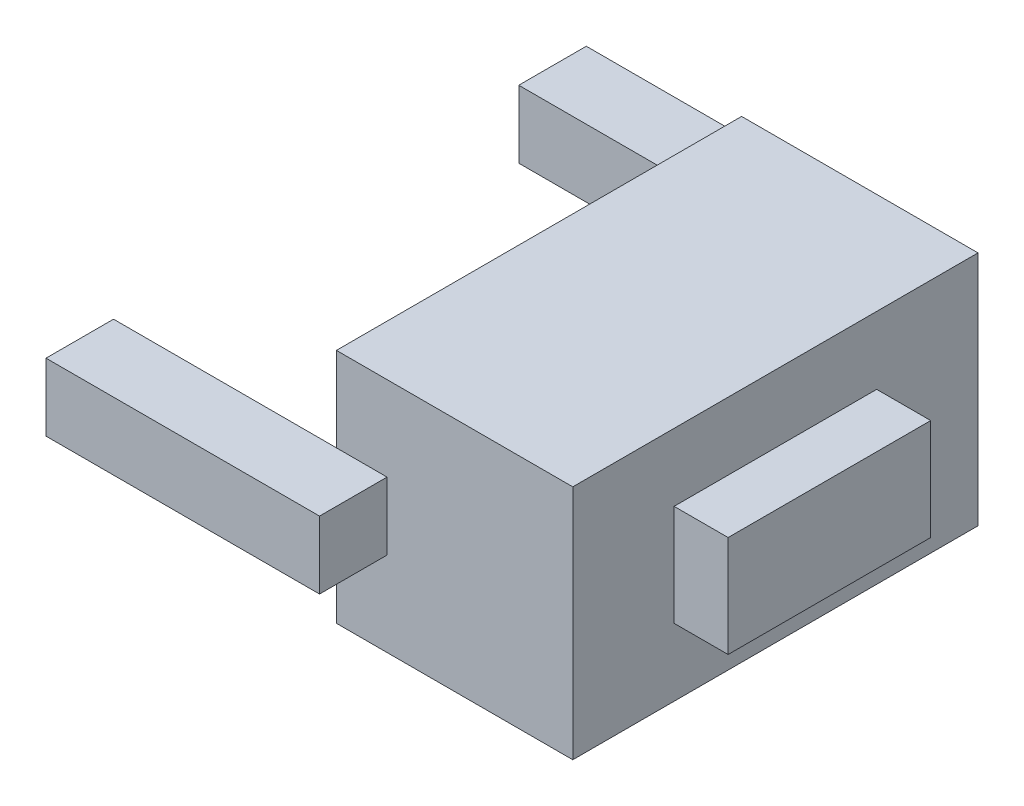
from build123d import *

# Parameters (mm, degrees)
SKETCH1_W            = 6
SKETCH1_H            = 3.5
BOSS_EXTRUDE1_DEPTH  = 3.5
SKETCH2_W            = 3
SKETCH2_H            = 1.5
BOSS_EXTRUDE2_DEPTH  = 0.8
SKETCH7_W            = 0.75
SKETCH7_H            = 1
BOSS_EXTRUDE7_DEPTH  = 1
SKETCH8_W            = 1
SKETCH8_H            = 1
BOSS_EXTRUDE8_DEPTH  = 3.3
SKETCH9_W            = 0.75
SKETCH9_H            = 1
BOSS_EXTRUDE9_DEPTH  = 1
SKETCH10_W           = 1
SKETCH10_H           = 1
BOSS_EXTRUDE10_DEPTH = 3.3


with BuildPart() as part:
    # Sketch1 → Boss-Extrude1 (new body)
    with BuildSketch(Plane(origin=(0, 0, 0), x_dir=(0, 0, -1), z_dir=(1, 0, 0))):
        with Locations((3, 1.75)):
            Rectangle(SKETCH1_W, SKETCH1_H)
    extrude(amount=BOSS_EXTRUDE1_DEPTH)

    # Sketch2 → Boss-Extrude2 (add)
    with BuildSketch(Plane(origin=(3.5, 0, 0), x_dir=(0, 0, -1), z_dir=(1, 0, 0))):
        with Locations((3, 1.75)):
            Rectangle(SKETCH2_W, SKETCH2_H)
    extrude(amount=BOSS_EXTRUDE2_DEPTH)

    # Sketch7 → Boss-Extrude7 (add)
    with BuildSketch(Plane.XY):
        with Locations((0.375, 1.75)):
            Rectangle(SKETCH7_W, SKETCH7_H)
    extrude(amount=BOSS_EXTRUDE7_DEPTH)

    # Sketch8 → Boss-Extrude8 (add)
    with BuildSketch(Plane.ZY):
        with Locations((0.5, 1.75)):
            Rectangle(SKETCH8_W, SKETCH8_H)
    extrude(amount=BOSS_EXTRUDE8_DEPTH)

    # Sketch9 → Boss-Extrude9 (add)
    with BuildSketch(Plane(origin=(0, 0, -6), x_dir=(-1, 0, 0), z_dir=(0, 0, -1))):
        with Locations((-0.375, 1.75)):
            Rectangle(SKETCH9_W, SKETCH9_H)
    extrude(amount=BOSS_EXTRUDE9_DEPTH)

    # Sketch10 → Boss-Extrude10 (add)
    with BuildSketch(Plane.ZY):
        with Locations((-6.5, 1.75)):
            Rectangle(SKETCH10_W, SKETCH10_H)
    extrude(amount=BOSS_EXTRUDE10_DEPTH)


solid = part.part
